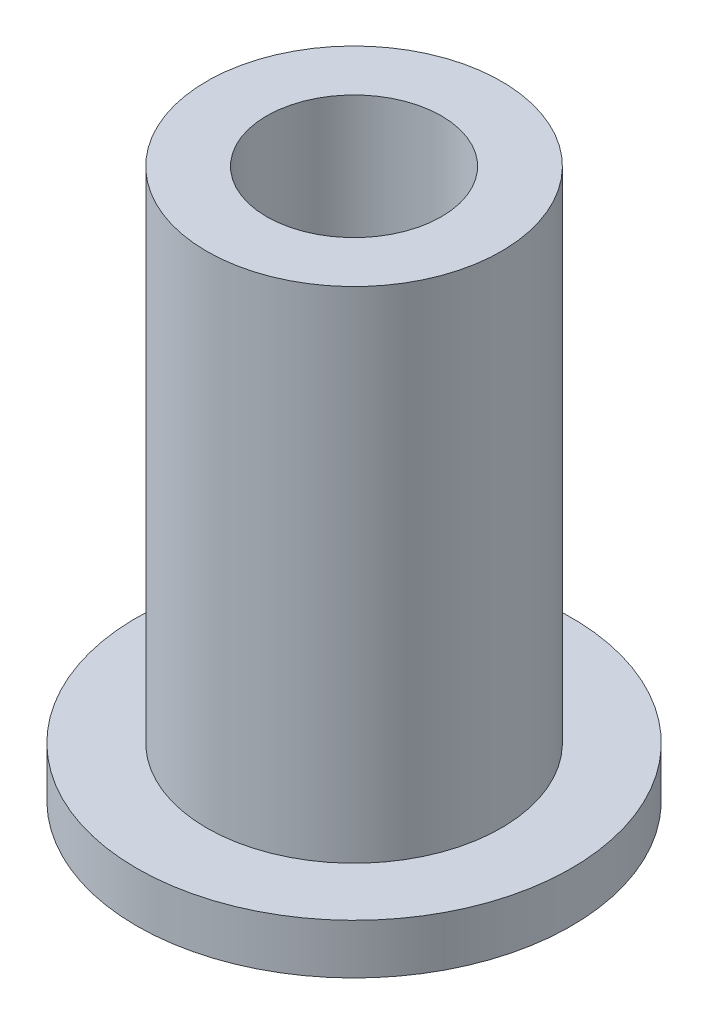
from build123d import *

# Parameters (mm, degrees)
SKETCH1_R           = 4.35
BOSS_EXTRUDE1_DEPTH = 1
SKETCH2_R           = 2.95
BOSS_EXTRUDE2_DEPTH = 10
SKETCH3_R           = 1.75
CUT_EXTRUDE1_DEPTH  = 13.603372565


with BuildPart() as part:
    # Sketch1 → Boss-Extrude1 (new body)
    with BuildSketch(Plane(origin=(0, 0, 0), x_dir=(1, 0, 0), z_dir=(0, 1, 0))):
        with Locations(Location((0, 0, 0), (0, 0, 270))):
            Circle(SKETCH1_R)
    extrude(amount=BOSS_EXTRUDE1_DEPTH)

    # Sketch2 → Boss-Extrude2 (add)
    with BuildSketch(Plane(origin=(0, 1, 0), x_dir=(1, 0, 0), z_dir=(0, 1, 0))):
        with Locations(Location((0, 0, 0), (0, 0, 270))):
            Circle(SKETCH2_R)
    extrude(amount=BOSS_EXTRUDE2_DEPTH)

    # Sketch3 → Cut-Extrude1 (cut, through all)
    with BuildSketch(Plane(origin=(0, 11, 0), x_dir=(1, 0, 0), z_dir=(0, 1, 0))):
        with Locations(Location((0, 0, 0), (0, 0, 270))):
            Circle(SKETCH3_R)
    extrude(amount=-CUT_EXTRUDE1_DEPTH, mode=Mode.SUBTRACT)


solid = part.part
